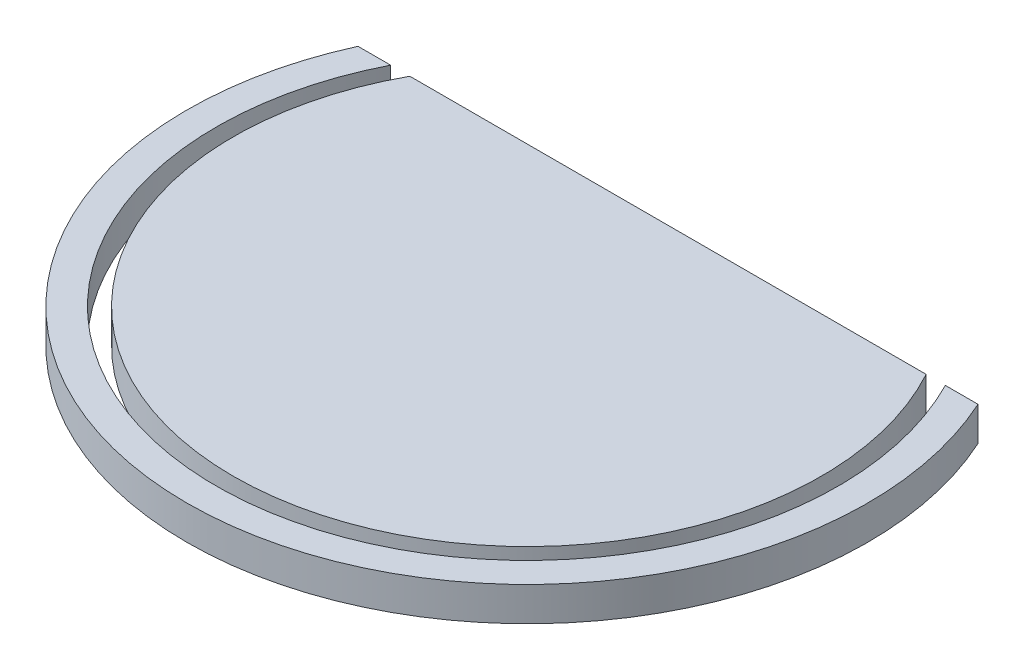
from build123d import *

# Parameters (mm, degrees)
AUFSATZ_LINEAR_AUSTRAGEN1_DEPTH   = 10
AUFSATZ_LINEAR_AUSTRAGEN1_2_DEPTH = 10


with BuildPart() as part:
    # Skizze1 → Aufsatz-Linear austragen1 (new body)
    with BuildSketch(Plane(origin=(0, 0, 0), x_dir=(1, 0, 0), z_dir=(0, 1, 0))):
        with BuildLine():
            ThreePointArc((-75.828335412, 41.329255816), (0, -86.359966638), (75.828335412, 41.329255816))
            Line((75.828335412, 41.329255816), (-75.828335412, 41.329255816))
        make_face()
    extrude(amount=AUFSATZ_LINEAR_AUSTRAGEN1_DEPTH)


with BuildPart() as body_2:
    # Skizze1 → Aufsatz-Linear austragen1 2 (new body)
    with BuildSketch(Plane(origin=(0, 0, 0), x_dir=(1, 0, 0), z_dir=(0, 1, 0))):
        with BuildLine():
            ThreePointArc((-91.059829858, 41.329255816), (0, -100), (91.059829858, 41.329255816))
            Line((91.059829858, 41.329255816), (81.47721226, 41.329255816))
            ThreePointArc((81.47721226, 41.329255816), (0, -91.359966638), (-81.47721226, 41.329255816))
            Line((-81.47721226, 41.329255816), (-91.059829858, 41.329255816))
        make_face()
    extrude(amount=AUFSATZ_LINEAR_AUSTRAGEN1_2_DEPTH)


solid = Compound([part.part, body_2.part])
